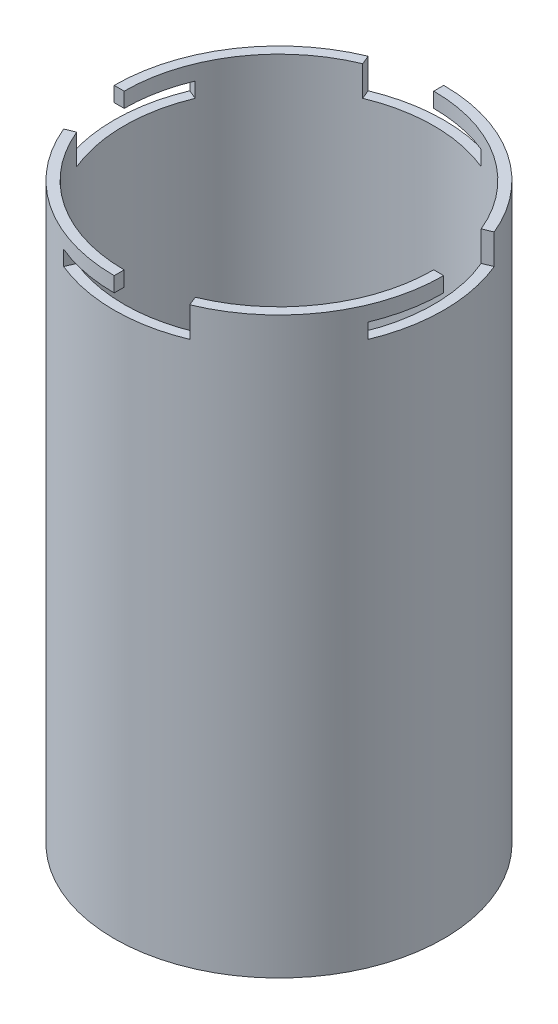
from build123d import *

# Parameters (mm, degrees)
SKETCH1_R           = 33
BOSS_EXTRUDE1_DEPTH = 109
SKETCH2_R           = 31
BOSS_EXTRUDE3_DEPTH = 3
BOSS_EXTRUDE4_DEPTH = 3
CUT_EXTRUDE1_START  = -115
SKETCH4_R           = 31
CUT_EXTRUDE1_DEPTH  = 115


with BuildPart() as part:
    # Sketch1 → Boss-Extrude1 (new body)
    with BuildSketch(Plane(origin=(0, 0, 0), x_dir=(1, 0, 0), z_dir=(0, 1, 0))):
        with Locations(Location((0, 0, 0), (0, 0, 270))):
            Circle(SKETCH1_R)
    extrude(amount=BOSS_EXTRUDE1_DEPTH)

    # Sketch2 → Boss-Extrude3 (add)
    with BuildSketch(Plane(origin=(0, 109, 0), x_dir=(1, 0, 0), z_dir=(0, 1, 0))):
        Circle(SKETCH2_R)
        with BuildLine():
            Line((-30.488024573, 12.628553268), (-28.640265508, 11.863186403))
            ThreePointArc((-28.640265508, 11.863186403), (-21.920310217, 21.920310217), (-11.863186403, 28.640265508))
            Line((-11.863186403, 28.640265508), (-12.628553268, 30.488024573))
            ThreePointArc((-12.628553268, 30.488024573), (-23.334523779, 23.334523779), (-30.488024573, 12.628553268))
        make_face()
        with BuildLine():
            ThreePointArc((11.863186403, 28.640265508), (21.920310217, 21.920310217), (28.640265508, 11.863186403))
            Line((28.640265508, 11.863186403), (30.488024573, 12.628553268))
            ThreePointArc((30.488024573, 12.628553268), (23.334523779, 23.334523779), (12.628553268, 30.488024573))
            Line((12.628553268, 30.488024573), (11.863186403, 28.640265508))
        make_face()
        with BuildLine():
            Line((30.488024573, -12.628553268), (28.640265508, -11.863186403))
            ThreePointArc((28.640265508, -11.863186403), (21.920310217, -21.920310217), (11.863186403, -28.640265508))
            Line((11.863186403, -28.640265508), (12.628553268, -30.488024573))
            ThreePointArc((12.628553268, -30.488024573), (23.334523779, -23.334523779), (30.488024573, -12.628553268))
        make_face()
        with BuildLine():
            Line((-12.628553268, -30.488024573), (-11.863186403, -28.640265508))
            ThreePointArc((-11.863186403, -28.640265508), (-21.920310217, -21.920310217), (-28.640265508, -11.863186403))
            Line((-28.640265508, -11.863186403), (-30.488024573, -12.628553268))
            ThreePointArc((-30.488024573, -12.628553268), (-23.334523779, -23.334523779), (-12.628553268, -30.488024573))
        make_face()
    extrude(amount=BOSS_EXTRUDE3_DEPTH)

    # Sketch3 → Boss-Extrude4 (add)
    with BuildSketch(Plane(origin=(0, 112, 0), x_dir=(1, 0, 0), z_dir=(0, 1, 0))):
        with BuildLine():
            Line((-33, 0), (-31, 0))
            ThreePointArc((-31, 0), (-30.404343693, -6.047799982), (-28.640265508, -11.863186403))
            Line((-28.640265508, -11.863186403), (-30.488024573, -12.628553268))
            ThreePointArc((-30.488024573, -12.628553268), (-18.33381769, -27.438497206), (0, -33))
            Line((0, -33), (0, -31))
            ThreePointArc((0, -31), (6.047799982, -30.404343693), (11.863186403, -28.640265508))
            Line((11.863186403, -28.640265508), (12.628553268, -30.488024573))
            ThreePointArc((12.628553268, -30.488024573), (27.438497206, -18.33381769), (33, 0))
            Line((33, 0), (31, 0))
            ThreePointArc((31, 0), (30.404343693, 6.047799982), (28.640265508, 11.863186403))
            Line((28.640265508, 11.863186403), (30.488024573, 12.628553268))
            ThreePointArc((30.488024573, 12.628553268), (18.33381769, 27.438497206), (0, 33))
            Line((0, 33), (0, 31))
            ThreePointArc((0, 31), (-6.047799982, 30.404343693), (-11.863186403, 28.640265508))
            Line((-11.863186403, 28.640265508), (-12.628553268, 30.488024573))
            ThreePointArc((-12.628553268, 30.488024573), (-27.438497206, 18.33381769), (-33, 0))
        make_face()
    extrude(amount=BOSS_EXTRUDE4_DEPTH)

    # Sketch4 → Cut-Extrude1 (cut)
    with BuildSketch(Plane(origin=(0, 115, 0), x_dir=(1, 0, 0), z_dir=(0, 1, 0)).offset(CUT_EXTRUDE1_START)):
        with Locations(Location((0, 0, 0), (0, 0, 270))):
            Circle(SKETCH4_R)
    extrude(amount=CUT_EXTRUDE1_DEPTH, mode=Mode.SUBTRACT)


solid = part.part
